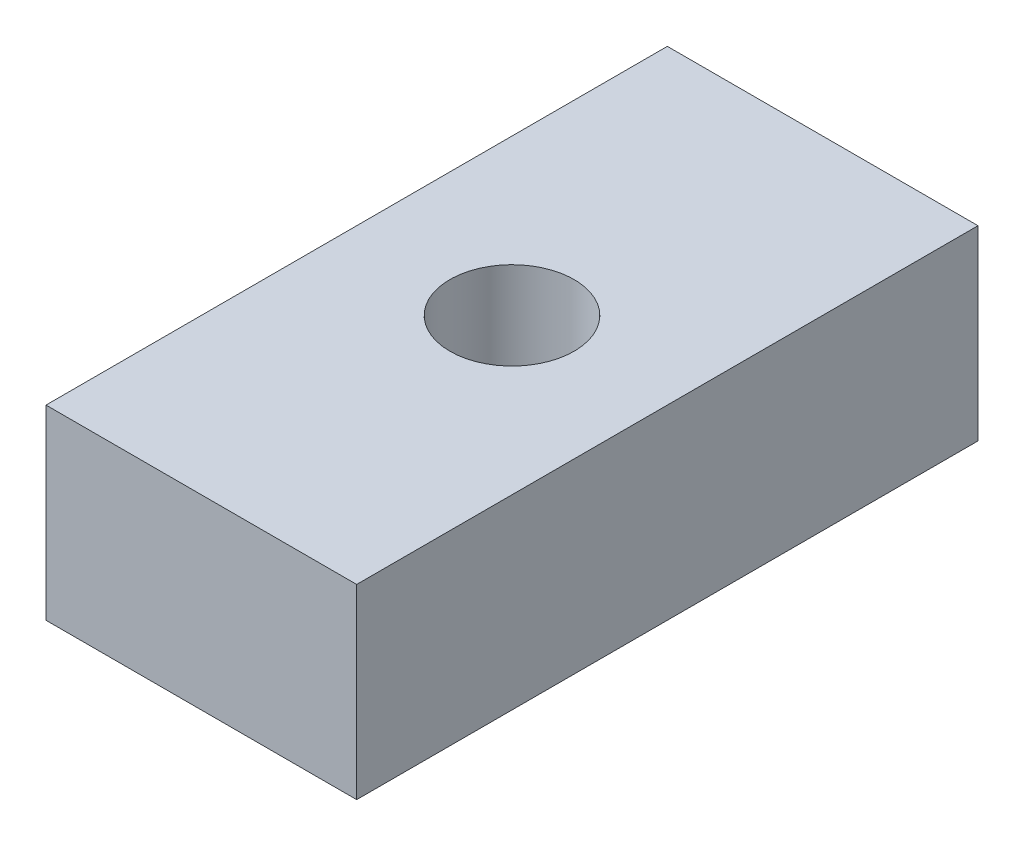
from build123d import *

# Parameters (mm, degrees)
ESQUISSE1_W             = 5
ESQUISSE1_H             = 10
BOSS_EXTRU_1_DEPTH      = 3
ESQUISSE2_R             = 1
ENL_V_MAT_EXTRU_1_DEPTH = 12.575836903


with BuildPart() as part:
    # Esquisse1 → Boss.-Extru.1 (new body)
    with BuildSketch(Plane(origin=(0, 0, 0), x_dir=(1, 0, 0), z_dir=(0, 1, 0))):
        with Locations((2.5, -5)):
            Rectangle(ESQUISSE1_W, ESQUISSE1_H)
    extrude(amount=BOSS_EXTRU_1_DEPTH)

    # Esquisse2 → Enlèv. mat.-Extru.1 (cut, through all)
    with BuildSketch(Plane(origin=(0, 3, 0), x_dir=(1, 0, 0), z_dir=(0, 1, 0))):
        with Locations(Location((2.5, -5, 0), (0, 0, 270))):
            Circle(ESQUISSE2_R)
    extrude(amount=-ENL_V_MAT_EXTRU_1_DEPTH, mode=Mode.SUBTRACT)


solid = part.part
